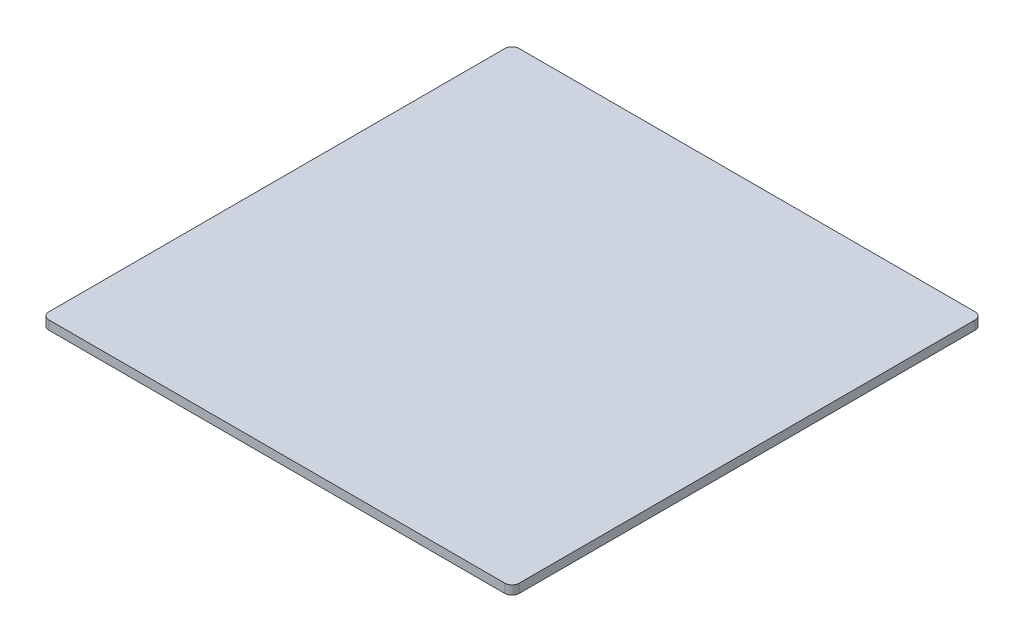
from build123d import *

# Parameters (mm, degrees)
SKETCH1_W           = 100
SKETCH1_H           = 100
BOSS_EXTRUDE1_DEPTH = 0.95
FILLET1_R           = 1.5


with BuildPart() as part:
    # Sketch1 → Boss-Extrude1 (new, symmetric)
    with BuildSketch(Plane(origin=(0, 0, 0), x_dir=(1, 0, 0), z_dir=(0, 1, 0))):
        Rectangle(SKETCH1_W, SKETCH1_H)
    extrude(amount=BOSS_EXTRUDE1_DEPTH, both=True)

    # Fillet1
    fillet1_edges = [part.edges().sort_by_distance(p)[0] for p in [
        (50, 0, 50),
        (-50, 0, 50),
        (-50, 0, -50),
        (50, 0, -50),
    ]]
    fillet(fillet1_edges, radius=FILLET1_R)


solid = part.part
